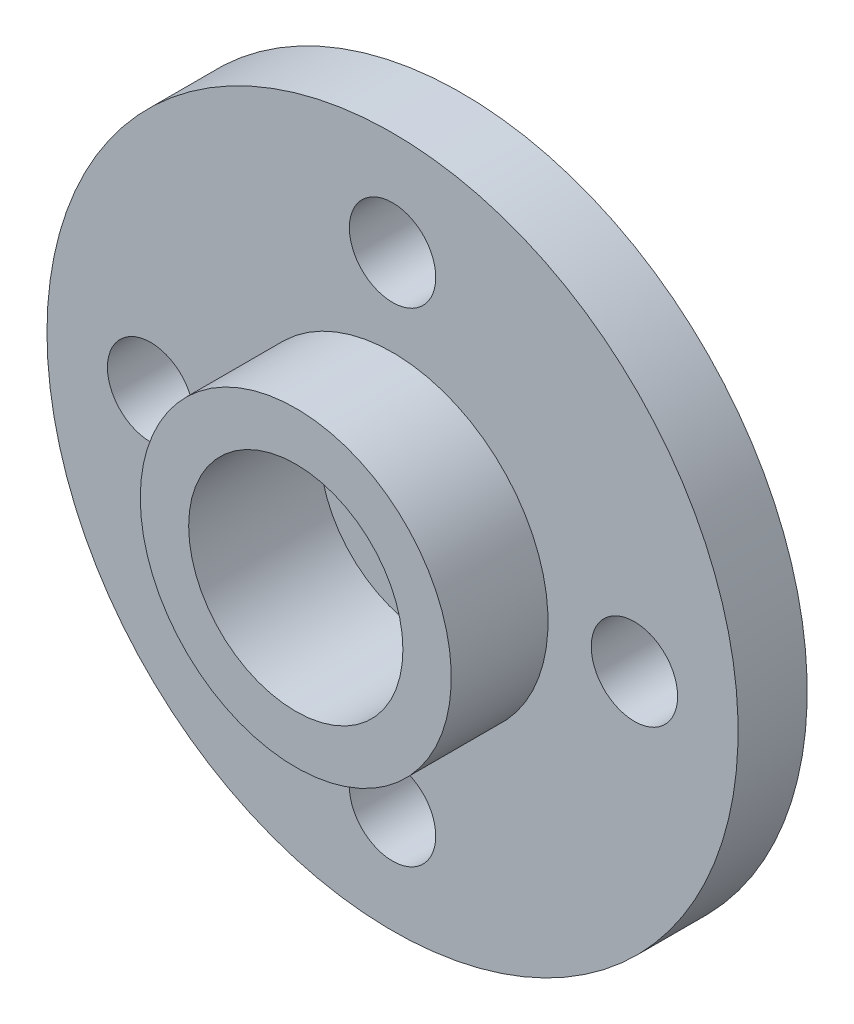
from build123d import *

# Parameters (mm, degrees)
SKETCH_1_W                   = 10
SKETCH_1_H                   = 2
SKETCH_2_R                   = 4.5
EXTRUDE_1_DEPTH              = 2.8
HOLE_WIZARD_2_5_2_5_1_D      = 2.5
HOLE_WIZARD_2_5_2_5_1_DEPTH  = 4.8
HOLE_WIZARD_M3_1_D           = 3.2
HOLE_WIZARD_M3_1_CBORE_D     = 6.2
HOLE_WIZARD_M3_1_CBORE_DEPTH = 3.8


with BuildPart() as part:
    # 草图1 → 旋转1 (revolve)
    with BuildSketch(Plane.XZ.offset(19.899998127), mode=Mode.PRIVATE) as revolve_1_sk:
        with Locations((-34.10264652, -35.124)):
            Rectangle(SKETCH_1_W, SKETCH_1_H)
    revolve(revolve_1_sk.sketch.rotate(Axis((-39.10264652, -19.899998127, -34.124), (0, 0, -1)), 180), axis=Axis((-39.10264652, -19.899998127, -34.124), (0, 0, -1)))

    # 草图2 → 凸台-拉伸1 (add)
    with BuildSketch(Plane.XY.offset(-34.124)):
        with Locations(Location((-39.10264652, -19.899998127, 0), (0, 0, 180))):
            Circle(SKETCH_2_R)
    extrude(amount=EXTRUDE_1_DEPTH)

    # Ø2.5 (2.5) 直径孔1
    with Locations(Plane(origin=(0, 0, -36.124), x_dir=(-1, 0, 0), z_dir=(0, 0, -1))):
        with Locations((46.102648393, -19.899998127), (39.10264652, -12.899996254), (32.102644647, -19.899998127), (39.10264652, -26.9)):
            Hole(HOLE_WIZARD_2_5_2_5_1_D / 2, depth=HOLE_WIZARD_2_5_2_5_1_DEPTH)

    # M3 六角头机械螺钉的柱形沉头孔1 (through all)
    with Locations(Plane.XY.offset(-31.324)):
        with Locations((-39.10264652, -19.899998127)):
            CounterBoreHole(HOLE_WIZARD_M3_1_D / 2, HOLE_WIZARD_M3_1_CBORE_D / 2, HOLE_WIZARD_M3_1_CBORE_DEPTH)


solid = part.part
